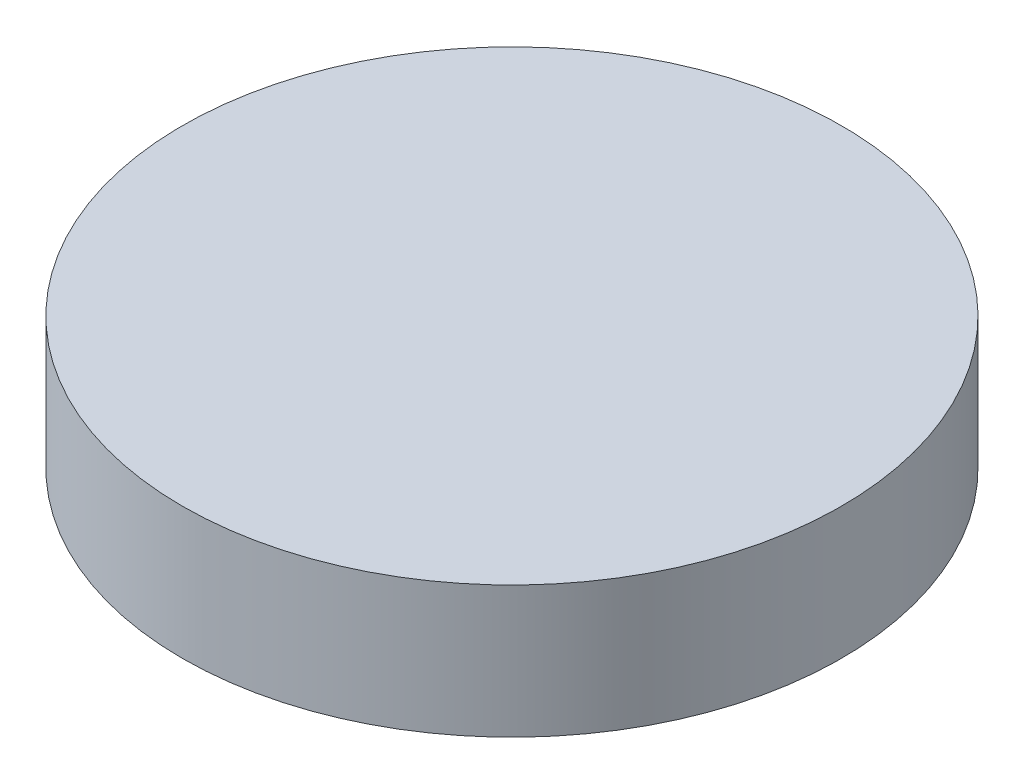
from build123d import *

# Parameters (mm, degrees)
SKETCH1_R           = 12.5
BOSS_EXTRUDE1_DEPTH = 5


with BuildPart() as part:
    # Sketch1 → Boss-Extrude1 (new body)
    with BuildSketch(Plane(origin=(0, 0, 0), x_dir=(1, 0, 0), z_dir=(0, 1, 0))):
        with Locations(Location((0, 0, 0), (0, 0, 270))):
            Circle(SKETCH1_R)
    extrude(amount=BOSS_EXTRUDE1_DEPTH)


solid = part.part
